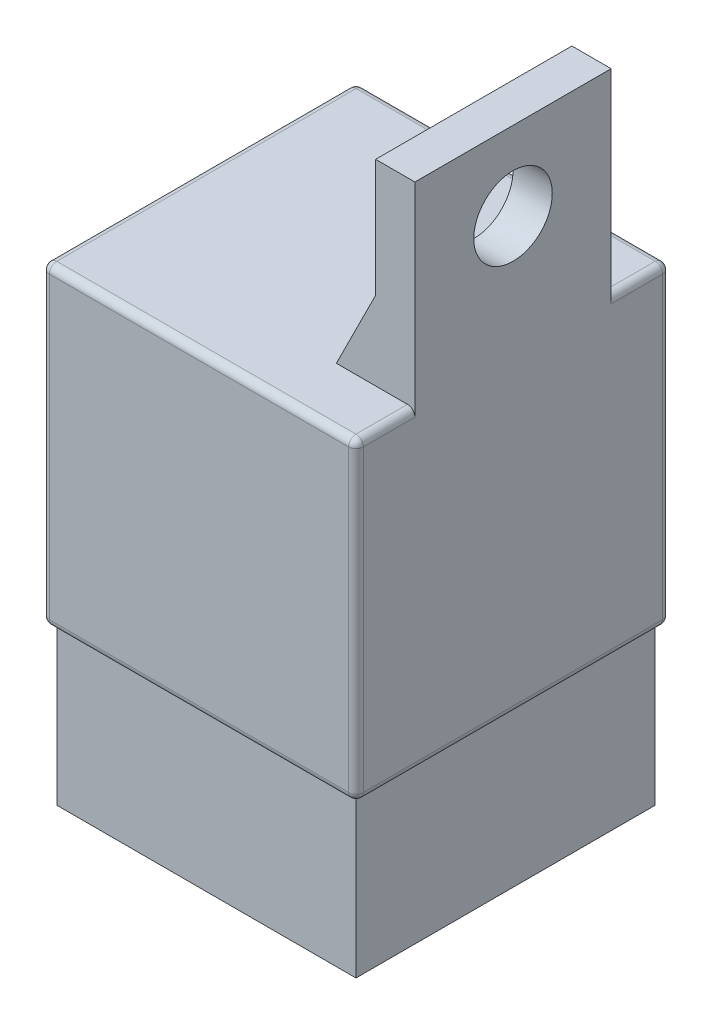
from build123d import *

# Parameters (mm, degrees)
SKETCH1_W           = 25.4
SKETCH1_H           = 25.4
BOSS_EXTRUDE1_DEPTH = 25.4
SKETCH2_W           = 3.175
SKETCH2_H           = 15.875
BOSS_EXTRUDE2_DEPTH = 15.875
BOSS_EXTRUDE3_DEPTH = 2.54
SKETCH8_R           = 3.175
CUT_EXTRUDE1_DEPTH  = 54.317316605
FILLET1_R           = 0.6
SKETCH9_W           = 24.2
SKETCH9_H           = 24.2
BOSS_EXTRUDE4_DEPTH = 12.7


with BuildPart() as part:
    # Sketch1 → Boss-Extrude1 (new body)
    with BuildSketch(Plane.XY):
        with Locations((-12.7, 12.7)):
            Rectangle(SKETCH1_W, SKETCH1_H)
    extrude(amount=BOSS_EXTRUDE1_DEPTH)

    # Sketch2 → Boss-Extrude2 (add)
    with BuildSketch(Plane(origin=(0, 25.4, 0), x_dir=(1, 0, 0), z_dir=(0, 1, 0))):
        with Locations((-1.5875, -12.7)):
            Rectangle(SKETCH2_W, SKETCH2_H)
    extrude(amount=BOSS_EXTRUDE2_DEPTH)

    # Sketch6 → Boss-Extrude3 (add)
    with BuildSketch(Plane.XY.offset(20.6375)):
        Polygon((-3.175, 25.4), (-6.35, 25.4), (-3.175, 31.75), align=None)
    boss_extrude3 = extrude(amount=-BOSS_EXTRUDE3_DEPTH)

    # Mirror1: Boss-Extrude3 across plane
    add(boss_extrude3.mirror(Plane.XY.offset(12.7)))

    # Sketch8 → Cut-Extrude1 (cut, through all)
    with BuildSketch(Plane.ZY.offset(3.175)):
        with Locations(Location((12.7, 34.925, 0), (0, 0, 270))):
            Circle(SKETCH8_R)
    extrude(amount=-CUT_EXTRUDE1_DEPTH, mode=Mode.SUBTRACT)

    # Fillet1
    fillet1_edges = [part.edges().sort_by_distance(p)[0] for p in [
        (-12.7, 25.4, 25.4),
        (0, 12.7, 25.4),
        (-25.4, 25.4, 12.7),
        (-25.4, 12.7, 25.4),
        (-12.7, 25.4, 0),
        (-25.4, 12.7, 0),
        (0, 12.7, 0),
        (-25.4, 0, 12.7),
        (-12.7, 0, 25.4),
        (0, 0, 12.7),
        (-12.7, 0, 0),
        (0, 25.4, 23.01875),
        (0, 25.4, 2.38125),
    ]]
    fillet(fillet1_edges, radius=FILLET1_R)

    # Sketch9 → Boss-Extrude4 (add)
    with BuildSketch(Plane(origin=(0, 0, 0), x_dir=(-1, 0, 0), z_dir=(0, -1, 0))):
        with Locations((12.7, -12.7)):
            Rectangle(SKETCH9_W, SKETCH9_H)
    extrude(amount=BOSS_EXTRUDE4_DEPTH)


solid = part.part
